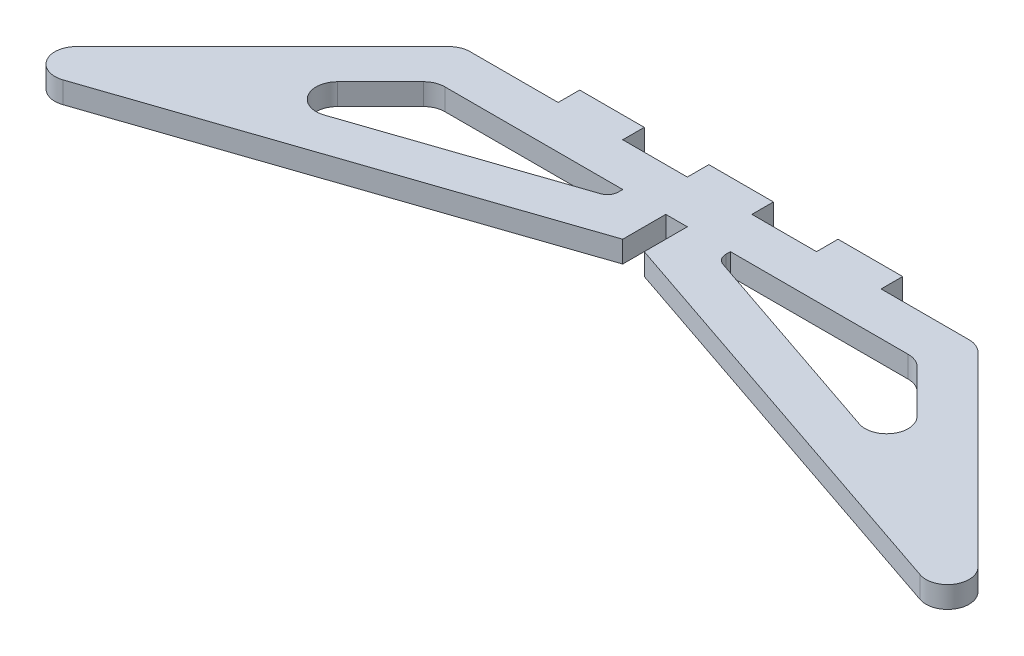
from build123d import *

# Parameters (mm, degrees)
BOSS_EXTRUDE1_DEPTH = 3.175


with BuildPart() as part:
    # Sketch1 → Boss-Extrude1 (new body)
    with BuildSketch(Plane(origin=(0, 0, 0), x_dir=(1, 0, 0), z_dir=(0, 1, 0))):
        with BuildLine():
            Line((-36.784871939, 0), (-23.8125, 0))
            Line((-23.8125, 0), (-23.8125, 3.175))
            Line((-23.8125, 3.175), (-14.2875, 3.175))
            Line((-14.2875, 3.175), (-14.2875, 0))
            Line((-14.2875, 0), (-4.7625, 0))
            Line((-4.7625, 0), (-4.7625, 3.175))
            Line((-4.7625, 3.175), (4.7625, 3.175))
            Line((4.7625, 3.175), (4.7625, 0))
            Line((4.7625, 0), (14.2875, 0))
            Line((14.2875, 0), (14.2875, 3.175))
            Line((14.2875, 3.175), (23.8125, 3.175))
            Line((23.8125, 3.175), (23.8125, 0))
            Line((23.8125, 0), (36.784871939, 0))
            ThreePointArc((36.784871939, 0), (37.999891837, -0.241682484), (39.02993597, -0.92993597))
            Line((39.02993597, -0.92993597), (66.469065694, -28.369065694))
            ThreePointArc((66.469065694, -28.369065694), (66.920159512, -32.290840151), (63.203219493, -33.620560958))
            Line((63.203219493, -33.620560958), (1.5875, -12.7))
            Line((1.5875, -12.7), (1.5875, -6.35))
            Line((1.5875, -6.35), (-1.5875, -6.35))
            Line((-1.5875, -6.35), (-1.5875, -12.7))
            Line((-1.5875, -12.7), (-63.203219493, -33.620560958))
            ThreePointArc((-63.203219493, -33.620560958), (-66.920159512, -32.290840151), (-66.469065694, -28.369065694))
            Line((-66.469065694, -28.369065694), (-39.02993597, -0.92993597))
            ThreePointArc((-39.02993597, -0.92993597), (-37.999891837, -0.241682484), (-36.784871939, 0))
        make_face()
        with BuildLine():
            Line((-39.452913677, -18.850511262), (-9.014608915, -8.515706841))
            ThreePointArc((-9.014608915, -8.515706841), (-8.234573307, -7.9371291), (-7.9375, -7.012491225))
            Line((-7.9375, -7.012491225), (-7.9375, -6.35))
            Line((-7.9375, -6.35), (-34.154615818, -6.35))
            ThreePointArc((-34.154615818, -6.35), (-35.369635716, -6.591682484), (-36.399679849, -7.27993597))
            Line((-36.399679849, -7.27993597), (-42.718759878, -13.599015999))
            ThreePointArc((-42.718759878, -13.599015999), (-43.169853696, -17.520790456), (-39.452913677, -18.850511262))
        make_face(mode=Mode.SUBTRACT)
        with BuildLine():
            Line((39.452913677, -18.850511262), (9.014608915, -8.515706841))
            ThreePointArc((9.014608915, -8.515706841), (8.234573307, -7.9371291), (7.9375, -7.012491225))
            Line((7.9375, -7.012491225), (7.9375, -6.35))
            Line((7.9375, -6.35), (34.154615818, -6.35))
            ThreePointArc((34.154615818, -6.35), (35.369635716, -6.591682484), (36.399679849, -7.27993597))
            Line((36.399679849, -7.27993597), (42.718759878, -13.599015999))
            ThreePointArc((42.718759878, -13.599015999), (43.169853696, -17.520790456), (39.452913677, -18.850511262))
        make_face(mode=Mode.SUBTRACT)
    extrude(amount=BOSS_EXTRUDE1_DEPTH)


solid = part.part
